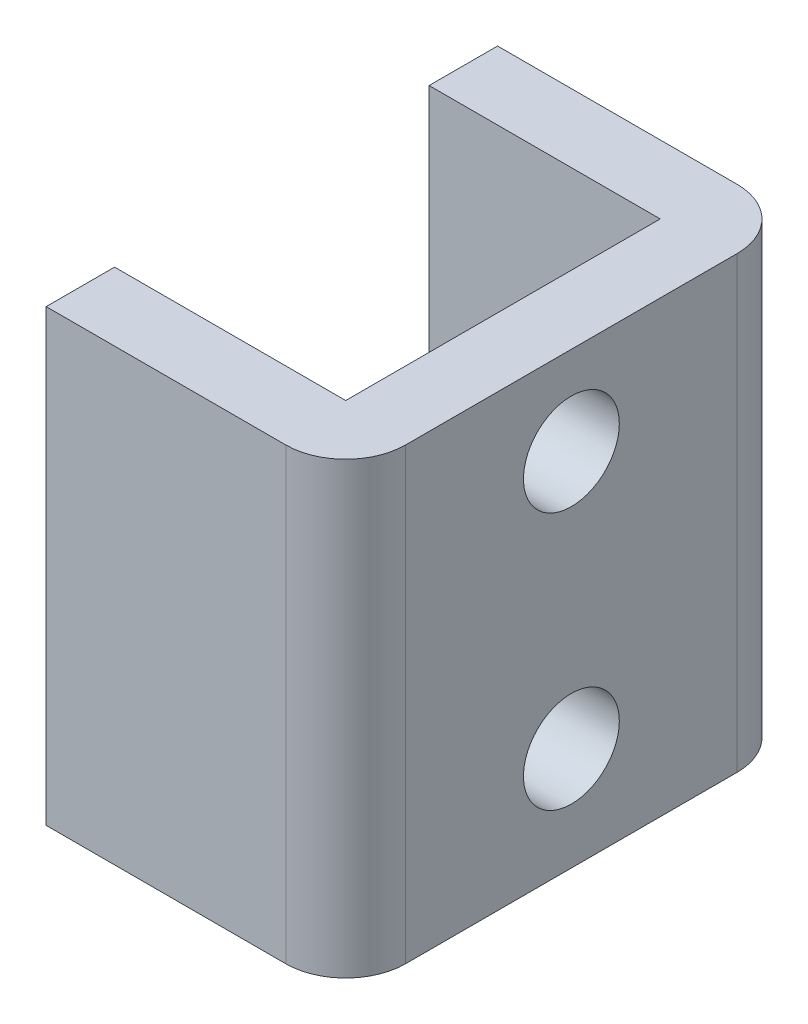
from build123d import *

# Parameters (mm, degrees)
EXTRUDE_4_DEPTH     = 15
SKETCH_6_W          = 5.43
SKETCH_6_H          = 10.5
CUT_EXTRUDE_2_DEPTH = 15
SKETCH_7_W          = 2.285
SKETCH_7_H          = 10.5
CUT_EXTRUDE_3_DEPTH = 15
SKETCH_8_R          = 1.6
CUT_EXTRUDE_4_DEPTH = 10


with BuildPart() as part:
    # 草图1 → 凸台-拉伸4 (new body)
    with BuildSketch(Plane(origin=(0, 0, 0), x_dir=(1, 0, 0), z_dir=(0, 1, 0))):
        with BuildLine():
            Line((-35.94125392, 35.792894198), (-35.94125392, 20.722894198))
            Line((-35.94125392, 20.722894198), (-27.94125392, 20.722894198))
            ThreePointArc((-27.94125392, 20.722894198), (-26.527040358, 21.308680636), (-25.94125392, 22.722894198))
            Line((-25.94125392, 22.722894198), (-25.94125392, 33.792894198))
            ThreePointArc((-25.94125392, 33.792894198), (-26.527040358, 35.207107761), (-27.94125392, 35.792894198))
            Line((-27.94125392, 35.792894198), (-35.94125392, 35.792894198))
        make_face()
    extrude(amount=EXTRUDE_4_DEPTH)

    # 草图6 → 切除-拉伸2 (cut)
    with BuildSketch(Plane(origin=(0, 15, 0), x_dir=(1, 0, 0), z_dir=(0, 1, 0))):
        with Locations((-30.94125392, 28.257894198)):
            Rectangle(SKETCH_6_W, SKETCH_6_H)
    extrude(amount=-CUT_EXTRUDE_2_DEPTH, mode=Mode.SUBTRACT)

    # 草图7 → 切除-拉伸3 (cut)
    with BuildSketch(Plane(origin=(0, 15, 0), x_dir=(1, 0, 0), z_dir=(0, 1, 0))):
        with Locations((-34.79875392, 28.257894198)):
            Rectangle(SKETCH_7_W, SKETCH_7_H)
    extrude(amount=-CUT_EXTRUDE_3_DEPTH, mode=Mode.SUBTRACT)

    # 草图8 → 切除-拉伸4 (cut)
    with BuildSketch(Plane(origin=(-25.94125392, 0, 0), x_dir=(0, 0, -1), z_dir=(1, 0, 0))):
        with Locations((28.257894198, 12.049892986)):
            Circle(SKETCH_8_R)
        with Locations((28.257894198, 3.449892986)):
            Circle(SKETCH_8_R)
    extrude(amount=-CUT_EXTRUDE_4_DEPTH, mode=Mode.SUBTRACT)


solid = part.part
